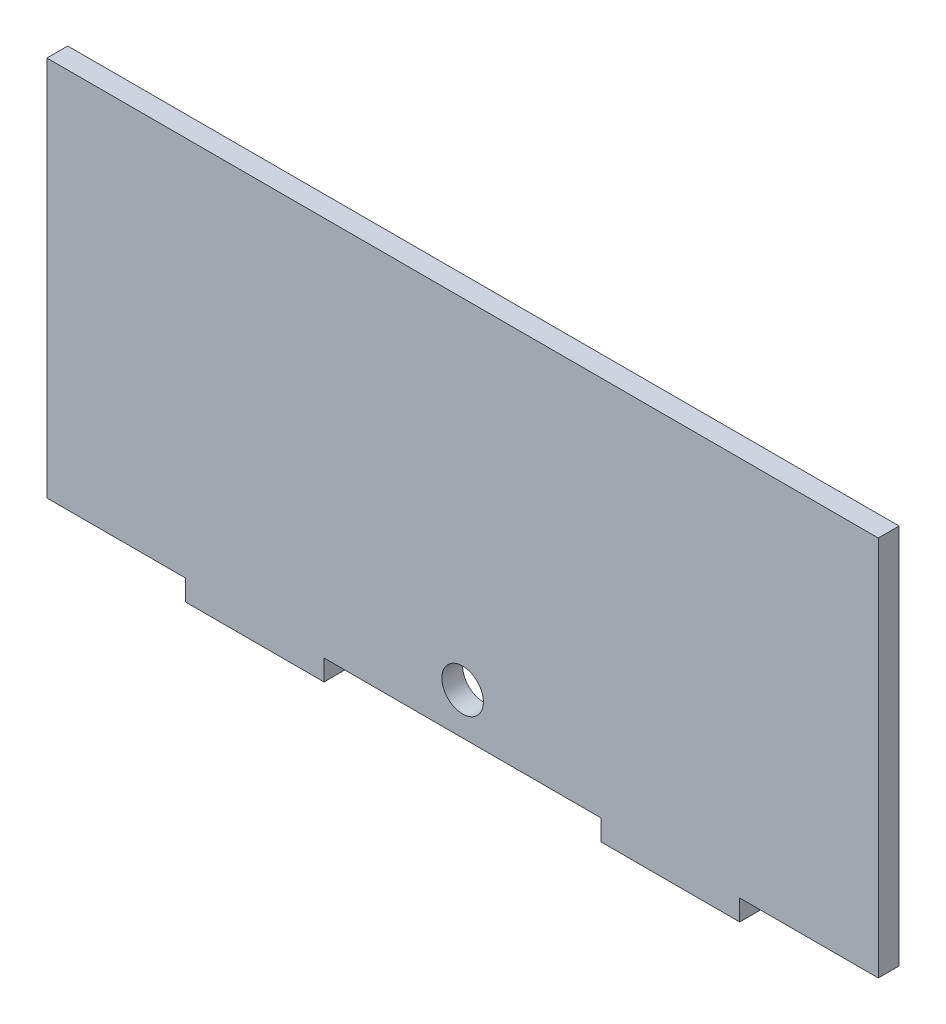
from build123d import *

# Parameters (mm, degrees)
SKETCH1_W           = 120
SKETCH1_H           = 55
SKETCH1_R           = 3
BOSS_EXTRUDE1_DEPTH = 3
SKETCH2_W           = 20
SKETCH2_H           = 3
BOSS_EXTRUDE2_DEPTH = 3


with BuildPart() as part:
    # Sketch1 → Boss-Extrude1 (new body)
    with BuildSketch(Plane.XY):
        with Locations((60, 27.5)):
            Rectangle(SKETCH1_W, SKETCH1_H)
        with Locations((60, 6)):
            Circle(SKETCH1_R, mode=Mode.SUBTRACT)
    extrude(amount=-BOSS_EXTRUDE1_DEPTH)

    # Sketch2 → Boss-Extrude2 (add)
    with BuildSketch(Plane.XY):
        with Locations((30, -1.5)):
            Rectangle(SKETCH2_W, SKETCH2_H)
        with Locations((90, -1.5)):
            Rectangle(SKETCH2_W, SKETCH2_H)
    extrude(amount=-BOSS_EXTRUDE2_DEPTH)


solid = part.part
